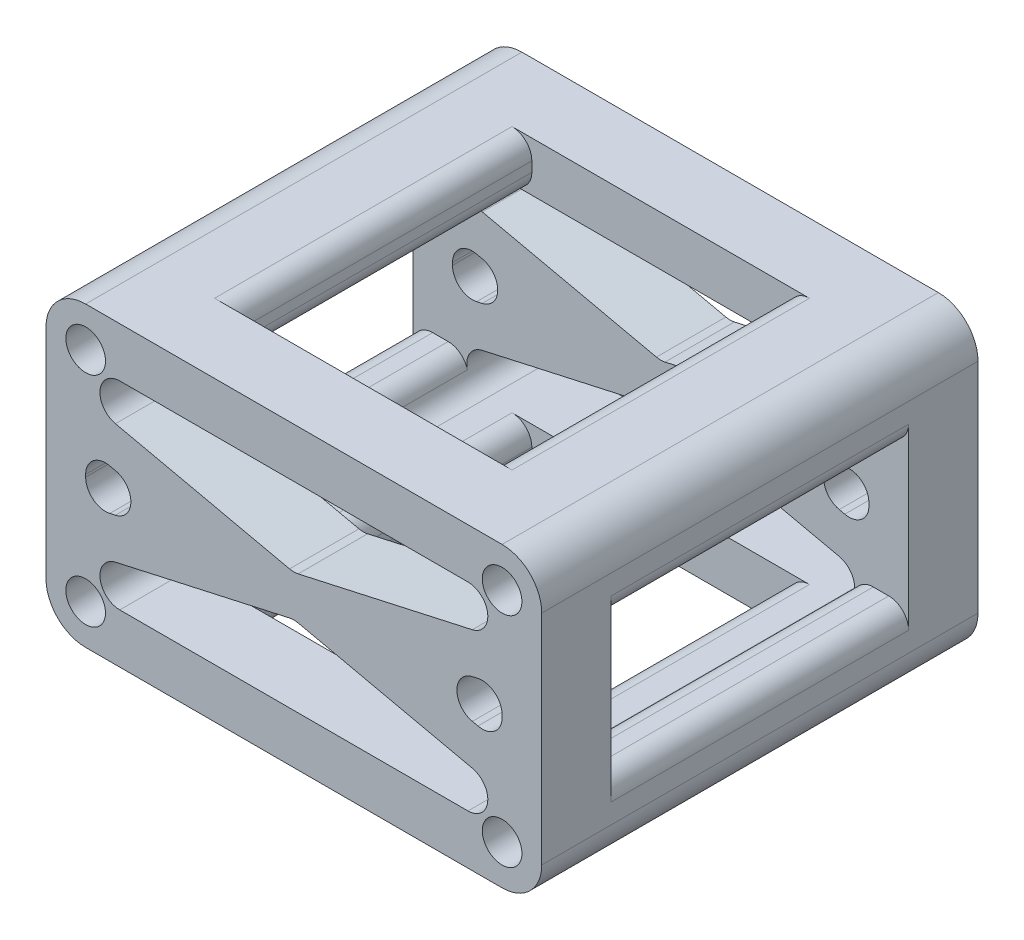
from build123d import *

# Parameters (mm, degrees)
SKETCH_1_W               = 25
SKETCH_1_H               = 15
EXTRUDE_1_DEPTH          = 22
FILLET_4_R               = 2
CUT_EXTRUDE_3_DEPTH      = 27.391286441
CUT_EXTRUDE_3_DEPTH_BACK = 27.391286441
CUT_EXTRUDE_4_DEPTH      = 27.391286441
CUT_EXTRUDE_4_DEPTH_BACK = 27.391286441
SKETCH_3_R               = 1
CUT_EXTRUDE_5_DEPTH      = 30.41513216
CUT_EXTRUDE_5_DEPTH_BACK = 30.41513216
SKETCH_4_W               = 13
SKETCH_4_H               = 15
SKETCH_5_W               = 15
SKETCH_5_H               = 7
CUT_EXTRUDE_6_DEPTH      = 35.135758377
FILLET_5_R               = 1


with BuildPart() as part:
    # 草图1 → 凸台-拉伸1 (new body)
    with BuildSketch(Plane.XY):
        Rectangle(SKETCH_1_W, SKETCH_1_H)
    extrude(amount=EXTRUDE_1_DEPTH)

    # 圆角4
    fillet_4_edges = [part.edges().sort_by_distance(p)[0] for p in [
        (12.5, -7.5, 11),
        (-12.5, -7.5, 11),
        (-12.5, 7.5, 11),
        (12.5, 7.5, 11),
    ]]
    fillet(fillet_4_edges, radius=FILLET_4_R)

    # 草图2 → 切除-拉伸3 (cut, two sides: drawn at the far end of the back side and taken through both)
    with BuildSketch(Plane.XY.offset(22).offset(-CUT_EXTRUDE_3_DEPTH_BACK)):
        with BuildLine():
            Line((-10.5, 0.062323454), (-10.5, -0.062323454))
            ThreePointArc((-10.5, -0.062323454), (-10.125727394, -0.842365266), (-9.283069542, -1.038510514))
            Line((-9.283069542, -1.038510514), (-9.002613999, -0.97618706))
            ThreePointArc((-9.002613999, -0.97618706), (-8.219544457, 0), (-9.002613999, 0.97618706))
            Line((-9.002613999, 0.97618706), (-9.283069542, 1.038510514))
            ThreePointArc((-9.283069542, 1.038510514), (-10.125727394, 0.842365266), (-10.5, 0.062323454))
        make_face()
        with BuildLine():
            Line((0.216930458, 1.072600597), (8.997386001, 3.02381294))
            ThreePointArc((8.997386001, 3.02381294), (9.774484481, 4.109116772), (8.780455543, 5))
            Line((8.780455543, 5), (-8.780455543, 5))
            ThreePointArc((-8.780455543, 5), (-9.774484481, 4.109116772), (-8.997386001, 3.02381294))
            Line((-8.997386001, 3.02381294), (-0.216930458, 1.072600597))
            ThreePointArc((-0.216930458, 1.072600597), (0, 1.048787657), (0.216930458, 1.072600597))
        make_face()
        with BuildLine():
            Line((9.283069542, 1.038510514), (9.002613999, 0.97618706))
            ThreePointArc((9.002613999, 0.97618706), (8.219544457, 0), (9.002613999, -0.97618706))
            Line((9.002613999, -0.97618706), (9.283069542, -1.038510514))
            ThreePointArc((9.283069542, -1.038510514), (10.125727394, -0.842365266), (10.5, -0.062323454))
            Line((10.5, -0.062323454), (10.5, 0.062323454))
            ThreePointArc((10.5, 0.062323454), (10.125727394, 0.842365266), (9.283069542, 1.038510514))
        make_face()
        with BuildLine():
            Line((8.780455543, -5), (-8.780455543, -5))
            ThreePointArc((-8.780455543, -5), (-9.774484481, -4.109116772), (-8.997386001, -3.02381294))
            Line((-8.997386001, -3.02381294), (-0.216930458, -1.072600597))
            ThreePointArc((-0.216930458, -1.072600597), (0, -1.048787657), (0.216930458, -1.072600597))
            Line((0.216930458, -1.072600597), (8.997386001, -3.02381294))
            ThreePointArc((8.997386001, -3.02381294), (9.774484481, -4.109116772), (8.780455543, -5))
        make_face()
    extrude(amount=CUT_EXTRUDE_3_DEPTH + CUT_EXTRUDE_3_DEPTH_BACK, mode=Mode.SUBTRACT)

    # 草图3 → 切除-拉伸4 (cut, two sides: drawn at the far end of the back side and taken through both)
    with BuildSketch(Plane.XY.offset(22).offset(-CUT_EXTRUDE_4_DEPTH_BACK)):
        with Locations((-10.5, 5.5)):
            Circle(SKETCH_3_R)
        with Locations(Location((10.5, 5.5, 0), (0, 0, 180))):
            Circle(SKETCH_3_R)
        with Locations((10.5, -5.5)):
            Circle(SKETCH_3_R)
        with Locations(Location((-10.5, -5.5, 0), (0, 0, 180))):
            Circle(SKETCH_3_R)
    extrude(amount=CUT_EXTRUDE_4_DEPTH + CUT_EXTRUDE_4_DEPTH_BACK, mode=Mode.SUBTRACT)

    # 草图4 → 切除-拉伸5 (cut, two sides: drawn at the far end of the back side and taken through both)
    with BuildSketch(Plane(origin=(0, 7.5, 0), x_dir=(1, 0, 0), z_dir=(0, 1, 0)).offset(-CUT_EXTRUDE_5_DEPTH_BACK)):
        with Locations((0, -11)):
            Rectangle(SKETCH_4_W, SKETCH_4_H)
    extrude(amount=CUT_EXTRUDE_5_DEPTH + CUT_EXTRUDE_5_DEPTH_BACK, mode=Mode.SUBTRACT)

    # 草图5 → 切除-拉伸6 (cut, through all)
    with BuildSketch(Plane.ZY.offset(12.5)):
        with Locations((11, 0)):
            Rectangle(SKETCH_5_W, SKETCH_5_H)
    extrude(amount=-CUT_EXTRUDE_6_DEPTH, mode=Mode.SUBTRACT)

    # 圆角5
    fillet_5_edges = [part.edges().sort_by_distance(p)[0] for p in [
        (-6.5, 5, 11),
        (-6.5, 7.5, 11),
        (-6.5, -5, 11),
        (-6.5, -7.5, 11),
        (6.5, 7.5, 11),
        (6.5, 5, 11),
        (6.5, -5, 11),
        (6.5, -7.5, 11),
        (9.646480946, 3.5, 11),
        (-9.646480946, -3.5, 11),
        (9.646480946, -3.5, 11),
        (12.5, -3.5, 11),
        (-9.646480946, 3.5, 11),
        (12.5, 3.5, 11),
        (-12.5, 3.5, 11),
        (-12.5, -3.5, 11),
    ]]
    fillet(fillet_5_edges, radius=FILLET_5_R)


solid = part.part
